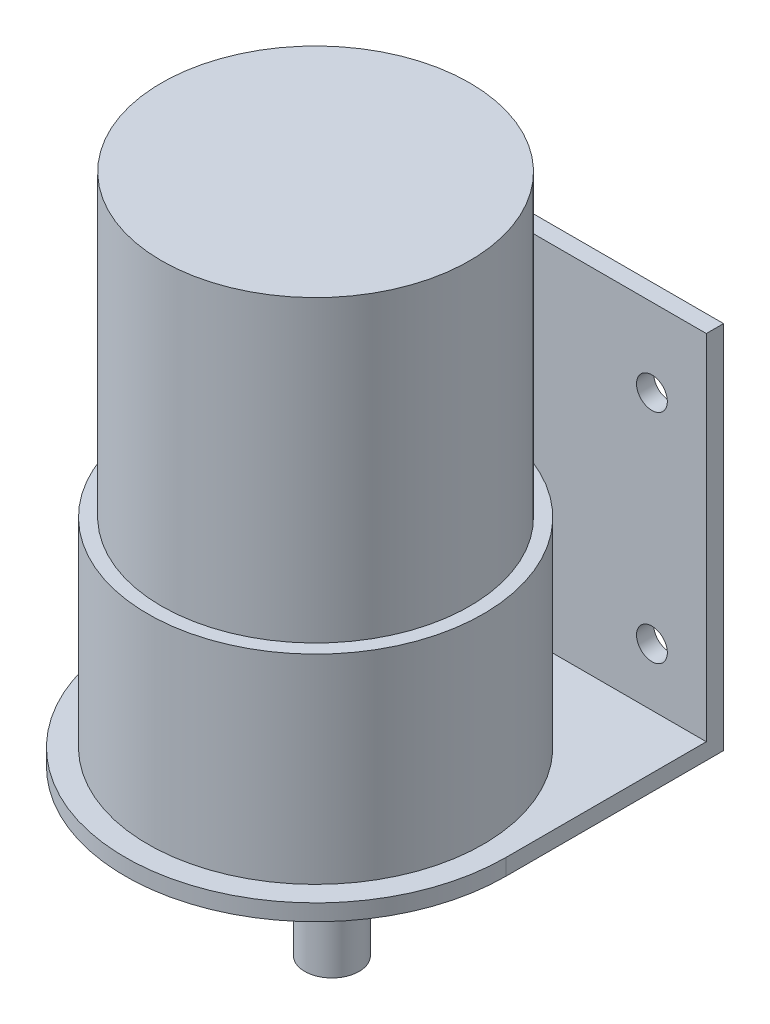
from build123d import *

# Parameters (mm, degrees)
SKETCH_1_R          = 17
EXTRUDE_1_DEPTH     = 33
SKETCH_2_R          = 18.5
EXTRUDE_2_DEPTH     = 22
EXTRUDE_3_DEPTH     = 1.8
SKETCH_4_W          = 42
SKETCH_4_H          = 1.9
EXTRUDE_4_DEPTH     = 39
SKETCH_5_R          = 6
EXTRUDE_5_DEPTH     = 4
SKETCH_6_R          = 3
EXTRUDE_6_DEPTH     = 15
CUT_EXTRUDE_1_REACH = 67.558
SKETCH_7_R          = 1.7


with BuildPart() as part:
    # 草图1 → 凸台-拉伸1 (new body)
    with BuildSketch(Plane(origin=(0, 0, 0), x_dir=(1, 0, 0), z_dir=(0, 1, 0))):
        with Locations(Location((0, 0, 0), (0, 0, 270))):
            Circle(SKETCH_1_R)
    extrude(amount=EXTRUDE_1_DEPTH)

    # 草图2 → 凸台-拉伸2 (add)
    with BuildSketch(Plane.XZ):
        with Locations(Location((0, 0, 0), (0, 0, 270))):
            Circle(SKETCH_2_R)
    extrude(amount=EXTRUDE_2_DEPTH)

    # 草图3 → 凸台-拉伸3 (add)
    with BuildSketch(Plane.XZ.offset(22)):
        with BuildLine():
            Line((-21, 0), (-21, -24))
            Line((-21, -24), (21, -24))
            Line((21, -24), (21, 0))
            ThreePointArc((21, 0), (0, 21), (-21, 0))
        make_face()
    extrude(amount=EXTRUDE_3_DEPTH)

    # 草图4 → 凸台-拉伸4 (add)
    with BuildSketch(Plane(origin=(0, -22, 0), x_dir=(1, 0, 0), z_dir=(0, 1, 0))):
        with Locations((0, 23.05)):
            Rectangle(SKETCH_4_W, SKETCH_4_H)
    extrude(amount=EXTRUDE_4_DEPTH)

    # 草图5 → 凸台-拉伸5 (add)
    with BuildSketch(Plane.XZ.offset(23.8)):
        with Locations(Location((0, -1.8, 0), (0, 0, 270))):
            Circle(SKETCH_5_R)
    extrude(amount=EXTRUDE_5_DEPTH)

    # 草图6 → 凸台-拉伸6 (add)
    with BuildSketch(Plane.XZ.offset(27.8)):
        with Locations(Location((0, -1.8, 0), (0, 0, 270))):
            Circle(SKETCH_6_R)
    extrude(amount=EXTRUDE_6_DEPTH)

    # 草图7 → 切除-拉伸1 (cut, up to next)
    with BuildSketch(Plane(origin=(0, 0, -24), x_dir=(-1, 0, 0), z_dir=(0, 0, -1)), mode=Mode.PRIVATE) as cut_extrude_1_sk1:
        with Locations((-15, 8.35)):
            Circle(SKETCH_7_R)
    cut_extrude_1_tool1 = extrude(cut_extrude_1_sk1.sketch, amount=-CUT_EXTRUDE_1_REACH, mode=Mode.PRIVATE) & part.part
    # 草图7 → 切除-拉伸1 (cut, up to next)
    with BuildSketch(Plane(origin=(0, 0, -24), x_dir=(-1, 0, 0), z_dir=(0, 0, -1)), mode=Mode.PRIVATE) as cut_extrude_1_sk2:
        with Locations((-15, -15.65)):
            Circle(SKETCH_7_R)
    cut_extrude_1_tool2 = extrude(cut_extrude_1_sk2.sketch, amount=-CUT_EXTRUDE_1_REACH, mode=Mode.PRIVATE) & part.part
    # 草图7 → 切除-拉伸1 (cut, up to next)
    with BuildSketch(Plane(origin=(0, 0, -24), x_dir=(-1, 0, 0), z_dir=(0, 0, -1)), mode=Mode.PRIVATE) as cut_extrude_1_sk3:
        with Locations((15, 8.35)):
            Circle(SKETCH_7_R)
    cut_extrude_1_tool3 = extrude(cut_extrude_1_sk3.sketch, amount=-CUT_EXTRUDE_1_REACH, mode=Mode.PRIVATE) & part.part
    # 草图7 → 切除-拉伸1 (cut, up to next)
    with BuildSketch(Plane(origin=(0, 0, -24), x_dir=(-1, 0, 0), z_dir=(0, 0, -1)), mode=Mode.PRIVATE) as cut_extrude_1_sk4:
        with Locations((15, -15.65)):
            Circle(SKETCH_7_R)
    cut_extrude_1_tool4 = extrude(cut_extrude_1_sk4.sketch, amount=-CUT_EXTRUDE_1_REACH, mode=Mode.PRIVATE) & part.part
    add(cut_extrude_1_tool1.solids().sort_by_distance((15, 8.35, -24))[0], mode=Mode.SUBTRACT)
    add(cut_extrude_1_tool2.solids().sort_by_distance((15, -15.65, -24))[0], mode=Mode.SUBTRACT)
    add(cut_extrude_1_tool3.solids().sort_by_distance((-15, 8.35, -24))[0], mode=Mode.SUBTRACT)
    add(cut_extrude_1_tool4.solids().sort_by_distance((-15, -15.65, -24))[0], mode=Mode.SUBTRACT)


solid = part.part
